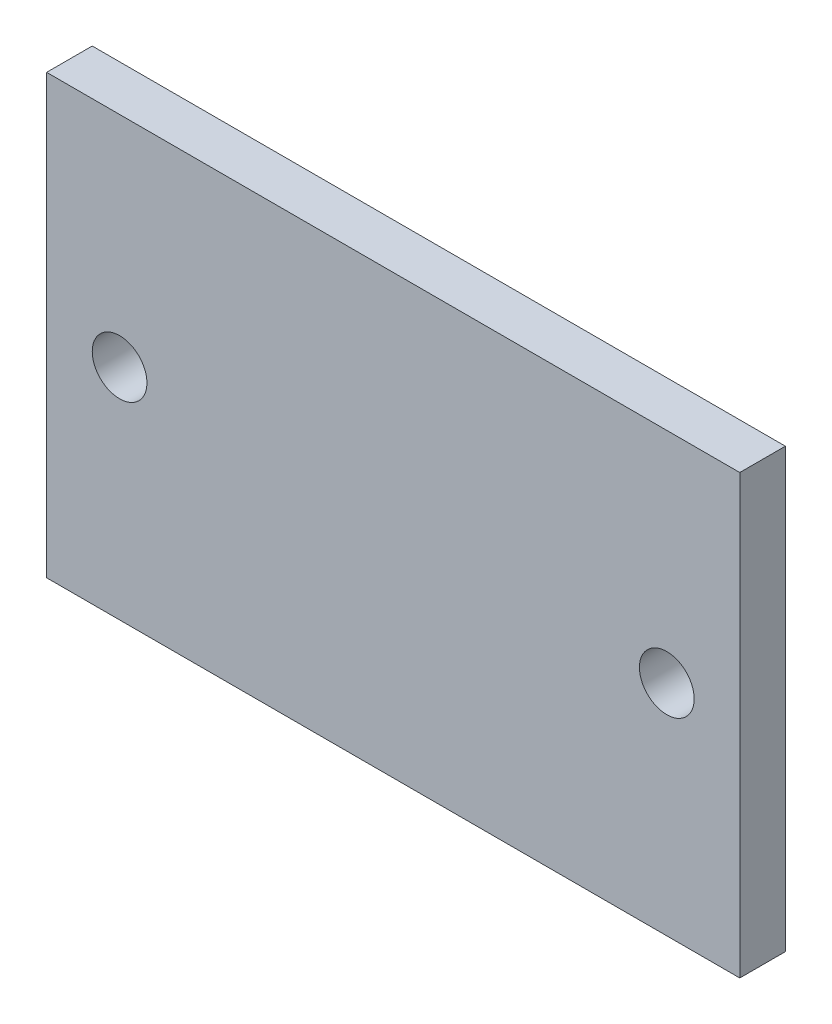
from build123d import *

# Parameters (mm, degrees)
SKETCH1_W           = 48.26
SKETCH1_H           = 30.48
BOSS_EXTRUDE1_DEPTH = 3.175
SKETCH2_R           = 1.905
CUT_EXTRUDE1_DEPTH  = 3.175


with BuildPart() as part:
    # Sketch1 → Boss-Extrude1 (new body)
    with BuildSketch(Plane.XY):
        with Locations((24.13, 15.24)):
            Rectangle(SKETCH1_W, SKETCH1_H)
    extrude(amount=BOSS_EXTRUDE1_DEPTH)

    # Sketch2 → Cut-Extrude1 (cut)
    with BuildSketch(Plane(origin=(0, 0, 0), x_dir=(-1, 0, 0), z_dir=(0, 0, -1))):
        with Locations((-5.08, 15.24)):
            Circle(SKETCH2_R)
        with Locations((-43.18, 15.24)):
            Circle(SKETCH2_R)
    extrude(amount=-CUT_EXTRUDE1_DEPTH, mode=Mode.SUBTRACT)


solid = part.part
